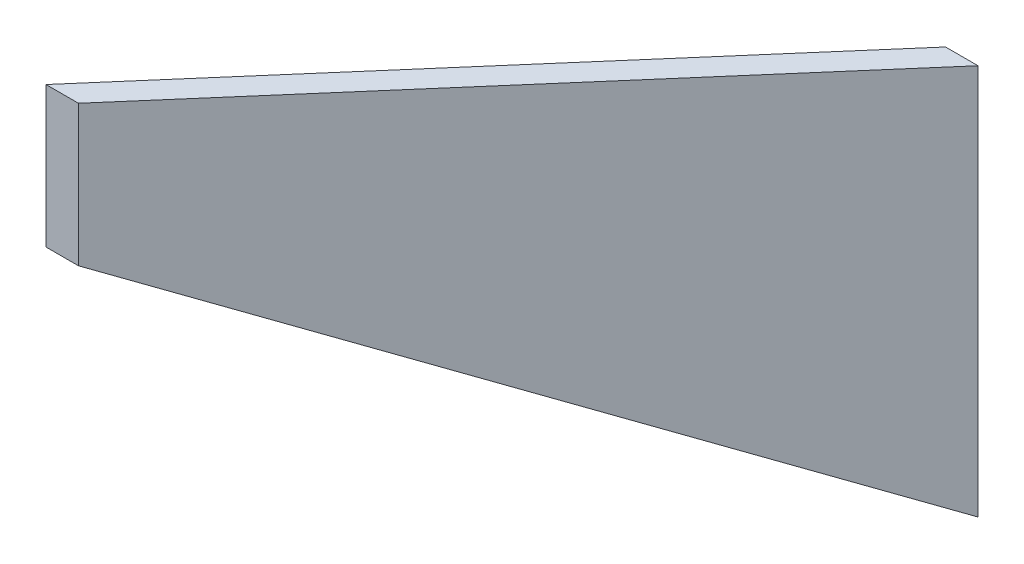
from build123d import *

# Parameters (mm, degrees)
BOSS_EXTRUDE1_DEPTH = 152.4
SKETCH3_OUTSIDE_W   = 237.922
SKETCH3_OUTSIDE_H   = 226.36
CUT_EXTRUDE2_DEPTH  = 365.792952335
SHELL1_T            = -6.35
SKETCH8_W           = 266.062607669
SKETCH8_H           = 282.191647152
CUT_EXTRUDE6_DEPTH  = 300.618382774
CUT_EXTRUDE3_DEPTH  = 350.742043935
SKETCH5_OUTSIDE_W   = 351.444
SKETCH5_OUTSIDE_H   = 196.758
CUT_EXTRUDE4_DEPTH  = 296.012320666


with BuildPart() as part:
    # Sketch2 → Boss-Extrude1 (new body)
    with BuildSketch(Plane(origin=(0, 0, 0), x_dir=(1, 0, 0), z_dir=(0, 1, 0))):
        Polygon((-57.15, 0), (224.536, 0), (-24.357683353, -163.961583236), align=None)
    extrude(amount=BOSS_EXTRUDE1_DEPTH)

    # Sketch3 outside → Cut-Extrude2 (cut, through all)
    with BuildSketch(Plane(origin=(-63.5, 0, 0), x_dir=(0, 0, -1), z_dir=(1, 0, 0))):
        with Locations((-81.981, 76.2)):
            Rectangle(SKETCH3_OUTSIDE_W, SKETCH3_OUTSIDE_H)
        Polygon((0, 152.4), (-127, 107.95), (-217.714285714, 76.2), (-127, 44.45), (0, 0), align=None, mode=Mode.SUBTRACT)
    extrude(amount=CUT_EXTRUDE2_DEPTH, mode=Mode.SUBTRACT)

    # Shell1
    shell1_openings = [part.faces().sort_by_distance(p)[0] for p in [
        (83.693, 76.2, 0),
    ]]
    offset(amount=SHELL1_T, openings=shell1_openings, kind=Kind.INTERSECTION)

    # Sketch8 → Cut-Extrude6 (cut, through all)
    with BuildSketch(Plane.XY.offset(127)):
        with Locations((40.834882022, 90.229060284)):
            Rectangle(SKETCH8_W, SKETCH8_H)
    extrude(amount=CUT_EXTRUDE6_DEPTH, mode=Mode.SUBTRACT)

    # Sketch4 → Cut-Extrude3 (cut, through all)
    with BuildSketch(Plane(origin=(-63.5, 0, 0), x_dir=(0, 0, -1), z_dir=(1, 0, 0))):
        Polygon((0, 152.4), (0, 145.672295618), (-163.961583236, 88.285741485), (-163.961583236, 95.013445867), align=None)
        Polygon((-163.961583236, 64.114258515), (0, 6.727704382), (0, 0), (-163.961583236, 57.386554133), align=None)
    extrude(amount=CUT_EXTRUDE3_DEPTH, mode=Mode.SUBTRACT)


with BuildPart() as cut_extrude3_piece_1:
    # of the separate pieces the step leaves, piece 1, a body of its own (cut_extrude3_pieces)
    add(part.part.solids().sort_by_distance((224.536, 6.727704382, 0))[0])


with BuildPart() as cut_extrude3_piece_2:
    # of the separate pieces the step leaves, piece 2, a body of its own (cut_extrude3_pieces)
    add(part.part.solids().sort_by_distance((-31.75, 51.177704382, 127))[0])

    # Sketch5 outside → Cut-Extrude4 (cut, through all)
    with BuildSketch(Plane(origin=(0, 149.86, 0), x_dir=(1, 0, 0), z_dir=(0, 1, 0))):
        with Locations((83.693, -63.5)):
            Rectangle(SKETCH5_OUTSIDE_W, SKETCH5_OUTSIDE_H)
        Polygon((-20.197755363, -152.382449275), (-18.635799907, -160.192226553), (344.317071882, -160.192226553), (317.879717865, 72.864270331), (-35.136715197, 43.31663937), align=None, mode=Mode.SUBTRACT)
    extrude(amount=-CUT_EXTRUDE4_DEPTH, mode=Mode.SUBTRACT)


solid = cut_extrude3_piece_1.part
